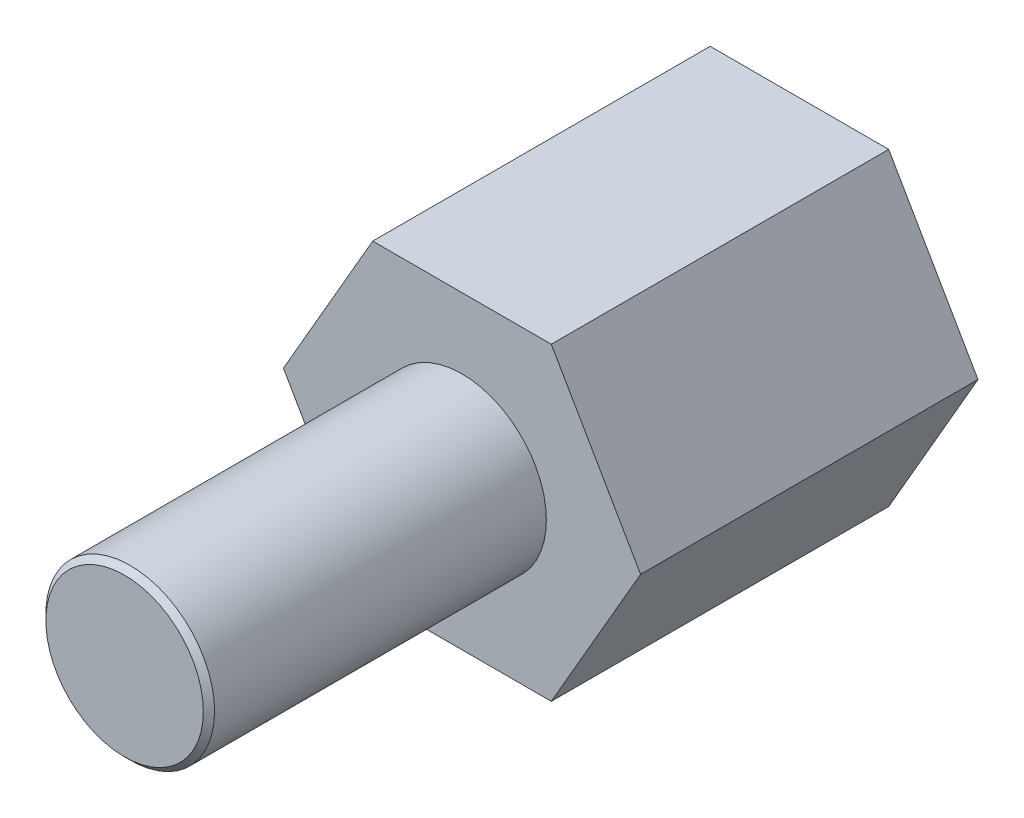
from build123d import *

# Parameters (mm, degrees)
EXTRUDE_1_DEPTH        = 6
SKETCH_2_R             = 1.5
EXTRUDE_2_DEPTH        = 6
HOLE_WIZARD_M3_1_D     = 2.5
HOLE_WIZARD_M3_1_DEPTH = 4
HOLE_WIZARD_M3_1_TIP   = 0.751075774
CHAMFER_1_SIZE         = 0.1


with BuildPart() as part:
    # 草图1 → 凸台-拉伸1 (new body)
    with BuildSketch(Plane.XY):
        Polygon((1.58771324, 2.75), (-1.58771324, 2.75), (-3.175426481, 0), (-1.58771324, -2.75), (1.58771324, -2.75), (3.175426481, 0), align=None)
    extrude(amount=EXTRUDE_1_DEPTH)

    # 草图2 → 凸台-拉伸2 (add)
    with BuildSketch(Plane.XY.offset(6)):
        Circle(SKETCH_2_R)
    extrude(amount=EXTRUDE_2_DEPTH)

    # M3 螺纹孔1
    with Locations(Plane(origin=(0, 0, 0), x_dir=(-1, 0, 0), z_dir=(0, 0, -1))):
        with Locations((0, 0)):
            Hole(HOLE_WIZARD_M3_1_D / 2, depth=HOLE_WIZARD_M3_1_DEPTH)
            with Locations((0, 0, -(HOLE_WIZARD_M3_1_DEPTH + HOLE_WIZARD_M3_1_TIP / 2))):  # 118° drill point
                Cone(0, HOLE_WIZARD_M3_1_D / 2, HOLE_WIZARD_M3_1_TIP, mode=Mode.SUBTRACT)

    # 倒角1
    chamfer_1_edges = [part.edges().sort_by_distance(p)[0] for p in [
        (-1.5, 0, 12),
    ]]
    chamfer(chamfer_1_edges, length=CHAMFER_1_SIZE)


solid = part.part
